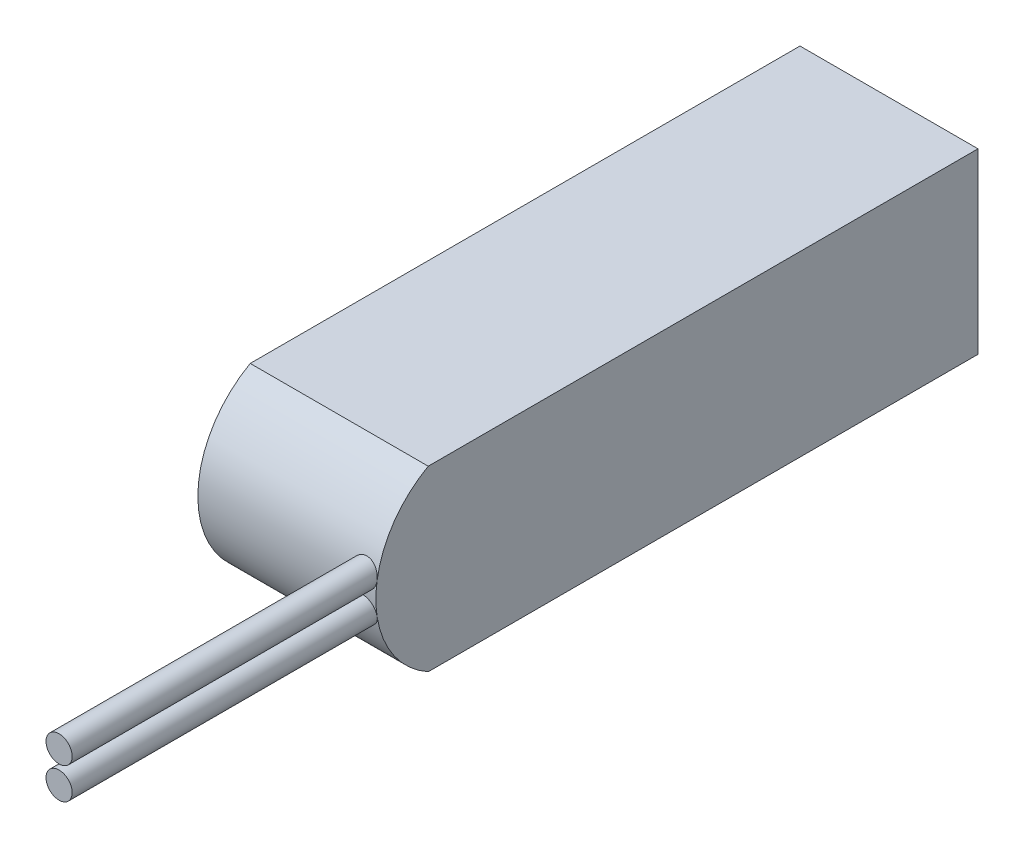
from build123d import *

# Parameters (mm, degrees)
ESQUISSE1_W        = 34
ESQUISSE1_H        = 34
BOSS_EXTRU_1_DEPTH = 105
BOSS_EXTRU_2_DEPTH = 34
ESQUISSE3_R        = 2.5
BOSS_EXTRU_3_DEPTH = 173


with BuildPart() as part:
    # Esquisse1 → Boss.-Extru.1 (new body)
    with BuildSketch(Plane.XY):
        with Locations((17, 17)):
            Rectangle(ESQUISSE1_W, ESQUISSE1_H)
    extrude(amount=BOSS_EXTRU_1_DEPTH)

    # Esquisse2 → Boss.-Extru.2 (add)
    with BuildSketch(Plane(origin=(34, 0, 0), x_dir=(0, 0, -1), z_dir=(1, 0, 0))):
        with BuildLine():
            Line((-105, 34), (-105, 0))
            ThreePointArc((-105, 0), (-115, 17), (-105, 34))
        make_face()
    extrude(amount=-BOSS_EXTRU_2_DEPTH)

    # Esquisse3 → Boss.-Extru.3 (add)
    with BuildSketch(Plane(origin=(0, 0, 0), x_dir=(-1, 0, 0), z_dir=(0, 0, -1))):
        with Locations((-31.5, 20)):
            Circle(ESQUISSE3_R)
        with Locations((-31.5, 14)):
            Circle(ESQUISSE3_R)
    extrude(amount=-BOSS_EXTRU_3_DEPTH)


solid = part.part
